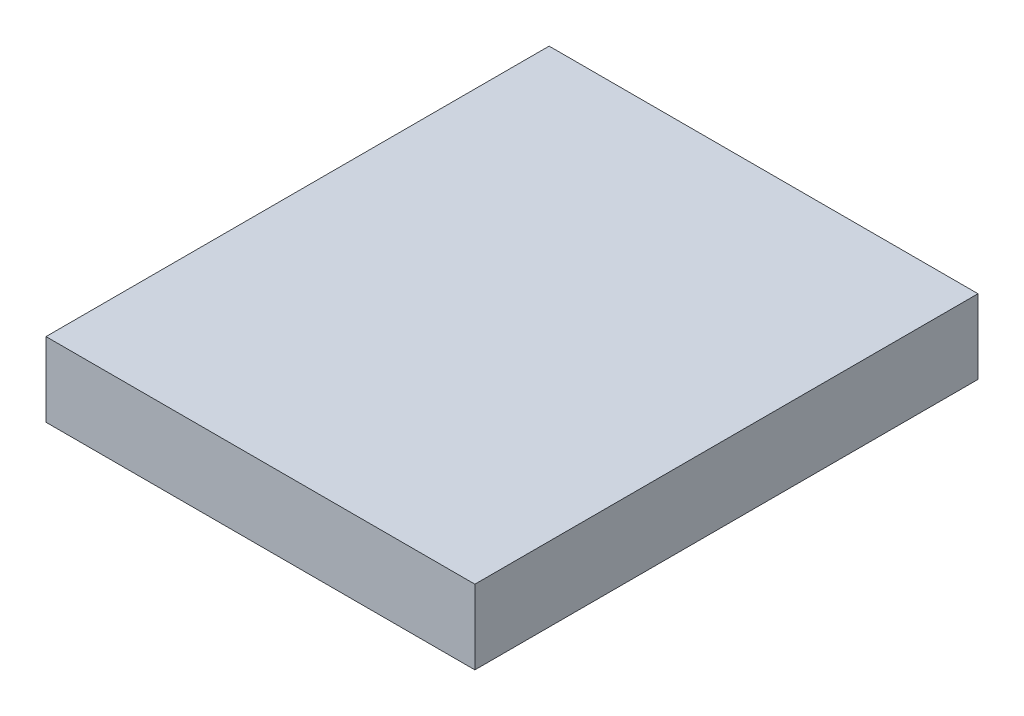
from build123d import *

# Parameters (mm, degrees)
SKETCH1_W           = 520
SKETCH1_H           = 610
BOSS_EXTRUDE1_DEPTH = 45
SHELL1_T            = -5


with BuildPart() as part:
    # Sketch1 → Boss-Extrude1 (new, symmetric)
    with BuildSketch(Plane(origin=(0, 0, 0), x_dir=(1, 0, 0), z_dir=(0, 1, 0))):
        Rectangle(SKETCH1_W, SKETCH1_H)
    extrude(amount=BOSS_EXTRUDE1_DEPTH, both=True)

    # Shell1
    shell1_openings = [part.faces().sort_by_distance(p)[0] for p in [
        (0, -45, 0),
    ]]
    offset(amount=SHELL1_T, openings=shell1_openings, kind=Kind.INTERSECTION)


solid = part.part
